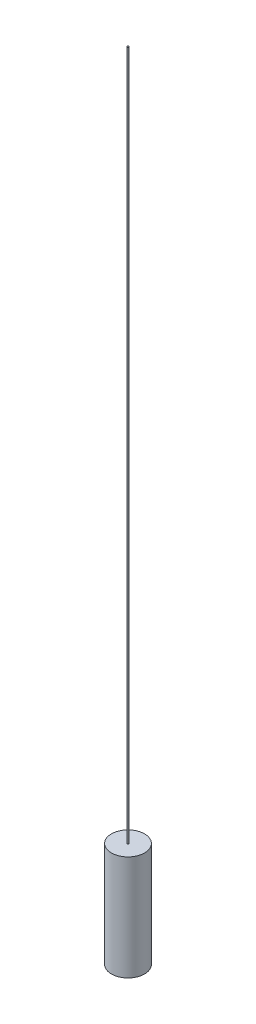
from build123d import *

# Parameters (mm, degrees)
SKETCH1_R           = 6
BOSS_EXTRUDE1_DEPTH = 38
SKETCH2_R           = 0.302488
BOSS_EXTRUDE2_DEPTH = 250


with BuildPart() as part:
    # Sketch1 → Boss-Extrude1 (new body)
    with BuildSketch(Plane(origin=(0, 0, 0), x_dir=(1, 0, 0), z_dir=(0, 1, 0))):
        with Locations(Location((0, 0, 0), (0, 0, 270))):
            Circle(SKETCH1_R)
    extrude(amount=BOSS_EXTRUDE1_DEPTH)

    # Sketch2 → Boss-Extrude2 (add)
    with BuildSketch(Plane(origin=(0, 38, 0), x_dir=(1, 0, 0), z_dir=(0, 1, 0))):
        with Locations(Location((0, 0, 0), (0, 0, 270))):
            Circle(SKETCH2_R)
    extrude(amount=BOSS_EXTRUDE2_DEPTH)


solid = part.part
